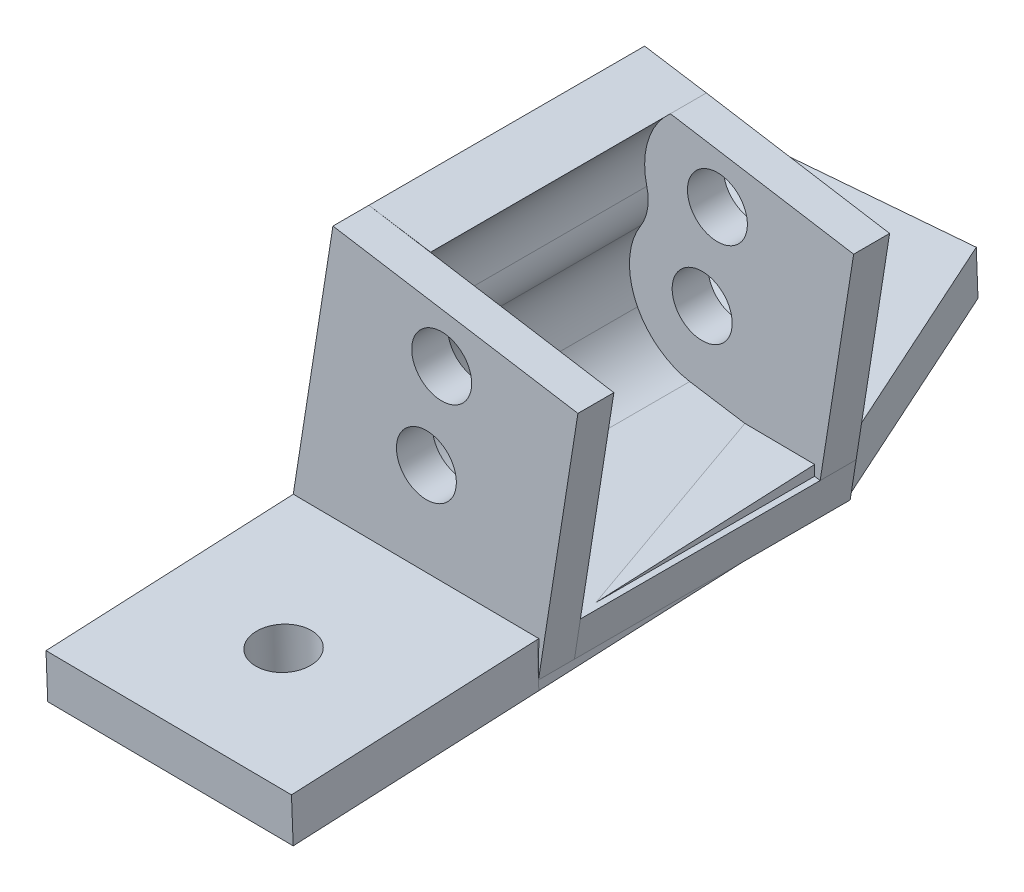
from build123d import *

# Parameters (mm, degrees)
BOSS_EXTRUDE1_DEPTH      = 29.21
SKETCH2_R                = 3.175
BOSS_EXTRUDE2_DEPTH      = 3.81
BOSS_EXTRUDE3_START      = -3.81
SKETCH3_R                = 3.175
SKETCH3_R_2              = 3.181823626
BOSS_EXTRUDE3_DEPTH      = 3.81
BOSS_EXTRUDE4_DEPTH      = 1.524
BOSS_EXTRUDE4_DEPTH_BACK = 3.302
SKETCH4_R                = 3.109705259
SKETCH4_R_2              = 2.977374329


with BuildPart() as part:
    # Sketch1 → Boss-Extrude1 (new body)
    with BuildSketch(Plane.XY):
        with BuildLine():
            Line((-445.741932109, 248.343634647), (-445.112071681, 252.347923806))
            Line((-445.112071681, 252.347923806), (-457.363663126, 254.275055523))
            Line((-457.363663126, 254.275055523), (-458.927145779, 254.520985778))
            ThreePointArc((-458.927145779, 254.520985778), (-462.17729329, 255.913510824), (-464.467858916, 258.607187485))
            ThreePointArc((-464.467858916, 258.607187485), (-465.308453245, 262.469514201), (-464.120754615, 266.239598875))
            ThreePointArc((-464.120754615, 266.239598875), (-463.399050509, 268.135245999), (-463.477224231, 270.162121354))
            ThreePointArc((-463.477224231, 270.162121354), (-463.334265537, 274.465295187), (-460.978145391, 278.068965549))
            Line((-460.978145391, 278.068965549), (-467.519631336, 279.097918))
            Line((-467.519631336, 279.097918), (-471.71455165, 252.429035234))
            Line((-471.71455165, 252.429035234), (-445.741932109, 248.343634647))
        make_face()
    extrude(amount=-BOSS_EXTRUDE1_DEPTH)

    # Sketch2 → Boss-Extrude2 (add)
    with BuildSketch(Plane.XY):
        Polygon((-467.519631336, 279.097918), (-471.71455165, 252.429035234), (-445.741932109, 248.343634647), (-441.565787186, 274.887665754), align=None)
        with Locations((-455.996603091, 271.987703521)):
            Circle(SKETCH2_R, mode=Mode.SUBTRACT)
        with Locations((-457.615851502, 262.119672583)):
            Circle(SKETCH2_R, mode=Mode.SUBTRACT)
    extrude(amount=BOSS_EXTRUDE2_DEPTH)

    # Sketch3 → Boss-Extrude3 (add)
    with BuildSketch(Plane(origin=(0, 0, -29.21), x_dir=(-1, 0, 0), z_dir=(0, 0, -1)).offset(BOSS_EXTRUDE3_START)):
        with BuildLine():
            Line((460.978145391, 278.068965549), (441.565787186, 274.887665754))
            Line((441.565787186, 274.887665754), (445.112071681, 252.347923806))
            Line((445.112071681, 252.347923806), (458.927145779, 254.520985778))
            ThreePointArc((458.927145779, 254.520985778), (464.657191184, 258.991661442), (464.120754615, 266.239598875))
            ThreePointArc((464.120754615, 266.239598875), (463.399050509, 268.135245999), (463.477224231, 270.162121354))
            ThreePointArc((463.477224231, 270.162121354), (463.334265537, 274.465295187), (460.978145391, 278.068965549))
        make_face()
        with Locations(Location((455.996603091, 271.987703521, 0), (0, 0, 180))):
            Circle(SKETCH3_R, mode=Mode.SUBTRACT)
        with Locations((457.611982645, 262.114049476)):
            Circle(SKETCH3_R_2, mode=Mode.SUBTRACT)
    extrude(amount=BOSS_EXTRUDE3_DEPTH)

    # Sketch4 → Boss-Extrude4 (add, two sides: drawn at the far end of the back side and taken through both)
    with BuildSketch(Plane(origin=(2.279673246, 246.113529363, 11.60731603), x_dir=(0.9999571992457364, -0.009241736857419818, -0.0004358629151659602), z_dir=(0.009252009328930062, 0.998846950490518, 0.04710806533037038)).offset(-BOSS_EXTRUDE4_DEPTH_BACK)):
        Polygon((-448.019641178, 7.893719141), (-448.019641178, -18.159221947), (-474.014513074, -18.159221947), (-474.028905268, 8.086182696), (-474.014513074, 41.069520713), (-483.533549488, 62.101622956), (-458.002958068, 64.465529415), (-448.005248984, 40.877057158), align=None)
        with Locations(Location((-465.863593213, 52.113287489, 0), (0, 0, 270))):
            Circle(SKETCH4_R, mode=Mode.SUBTRACT)
        with Locations(Location((-461.180575409, -5.817624253, 0), (0, 0, 270))):
            Circle(SKETCH4_R_2, mode=Mode.SUBTRACT)
    extrude(amount=BOSS_EXTRUDE4_DEPTH + BOSS_EXTRUDE4_DEPTH_BACK)


solid = part.part
